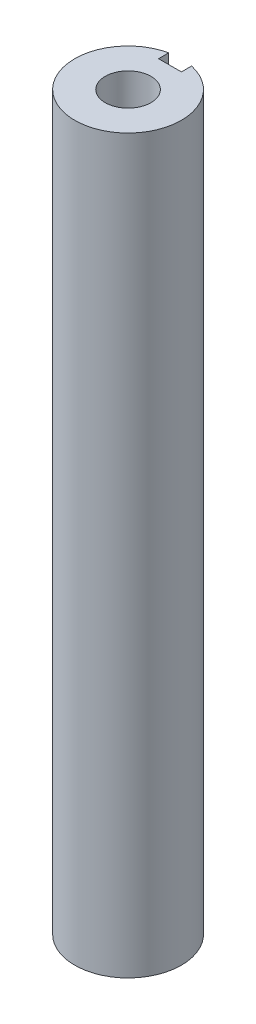
from build123d import *

# Parameters (mm, degrees)
SKETCH1_R   = 4.7625
SHAFT_DEPTH = 152.4


with BuildPart() as part:
    # Sketch1 → Shaft (new body)
    with BuildSketch(Plane(origin=(0, 0, 0), x_dir=(1, 0, 0), z_dir=(0, 1, 0))):
        with BuildLine():
            Line((-2.38125, 10.854368), (-2.38125, 8.73125))
            Line((-2.38125, 8.73125), (2.38125, 8.73125))
            Line((2.38125, 8.73125), (2.38125, 10.854368))
            ThreePointArc((2.38125, 10.854368), (0, -11.1125), (-2.38125, 10.854368))
        make_face()
        with Locations(Location((0, 0, 0), (0, 0, 90))):
            Circle(SKETCH1_R, mode=Mode.SUBTRACT)
    extrude(amount=SHAFT_DEPTH)


solid = part.part
